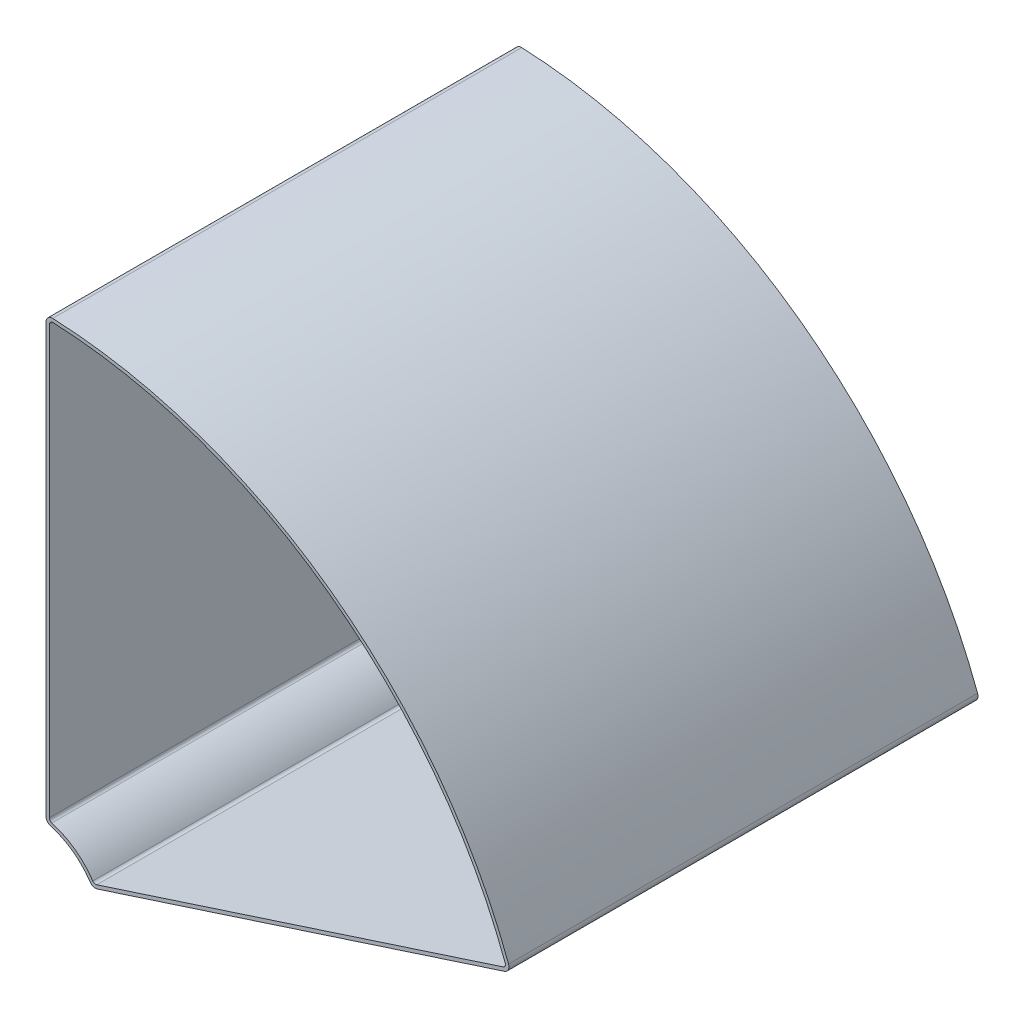
from build123d import *

# Parameters (mm, degrees)
EXTRUDE_1_DEPTH = 220
EXTRUDE_2_DEPTH = 1.6
FILLET_1_R      = 1.6
FILLET_2_R      = 3


with BuildPart() as part:
    # 스케치1 → 보스-돌출1 (new body)
    with BuildSketch(Plane.XY):
        with BuildLine():
            Line((7, 238.897467546), (7, 32.658230203))
            ThreePointArc((7, 32.658230203), (19.632027427, 27.021167612), (28.896703685, 16.749343753))
            Line((28.896703685, 16.749343753), (225.041874276, 80.480772999))
            ThreePointArc((225.041874276, 80.480772999), (140.480675298, 193.355061656), (7, 238.897467546))
        make_face()
        with BuildLine():
            ThreePointArc((8.6, 237.244178011), (139.540218894, 192.060634465), (222.975075299, 81.491568862))
            Line((222.975075299, 81.491568862), (29.608929649, 18.663099556))
            ThreePointArc((29.608929649, 18.663099556), (20.57248383, 28.315594803), (8.6, 33.926980414))
            Line((8.6, 33.926980414), (8.6, 237.244178011))
        make_face(mode=Mode.SUBTRACT)
    extrude(amount=EXTRUDE_1_DEPTH)

    # 스케치1<3> → 보스-돌출2 (add)
    with BuildSketch(Plane.XY):
        with BuildLine():
            ThreePointArc((222.975075299, 81.491568862), (139.540218894, 192.060634465), (8.6, 237.244178011))
            Line((8.6, 237.244178011), (8.6, 33.926980414))
            ThreePointArc((8.6, 33.926980414), (20.57248383, 28.315594803), (29.608929649, 18.663099556))
            Line((29.608929649, 18.663099556), (222.975075299, 81.491568862))
        make_face()
    extrude(amount=EXTRUDE_2_DEPTH)

    # 필렛1
    fillet_1_edges = [part.edges().sort_by_distance(p)[0] for p in [
        (29.608929649, 18.663099556, 110.8),
        (8.6, 33.926980414, 110.8),
        (8.6, 237.244178011, 110.8),
        (222.975075299, 81.491568862, 110.8),
    ]]
    fillet(fillet_1_edges, radius=FILLET_1_R)

    # 필렛2
    fillet_2_edges = [part.edges().sort_by_distance(p)[0] for p in [
        (28.896703685, 16.749343753, 110),
        (7, 32.658230203, 110),
        (225.041874276, 80.480772999, 110),
        (7, 238.897467546, 110),
    ]]
    fillet(fillet_2_edges, radius=FILLET_2_R)


solid = part.part
